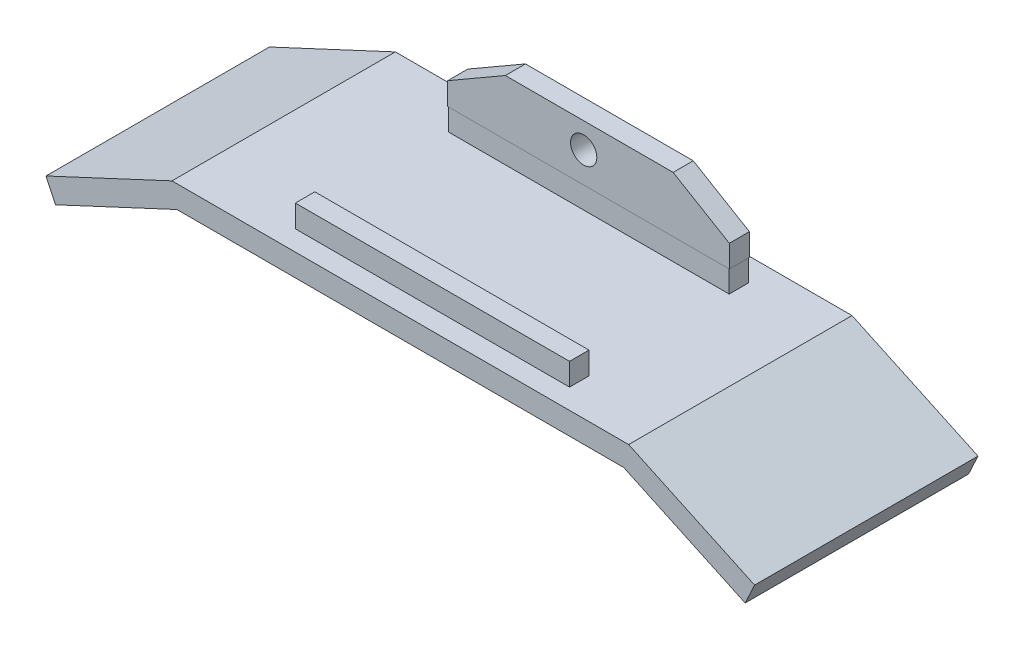
from build123d import *

# Parameters (mm, degrees)
EXTRUDE_THIN1_DEPTH = 25.4
SKETCH3_W           = 31.939411296
SKETCH3_H           = 2.21446585
BOSS_EXTRUDE1_DEPTH = 2.54
SKETCH4_W           = 31.172865425
SKETCH4_H           = 2.21446585
BOSS_EXTRUDE2_DEPTH = 2.54
BOSS_EXTRUDE3_DEPTH = 2.286
SKETCH10_R          = 1.491946279
CUT_EXTRUDE1_DEPTH  = 70.737718879


with BuildPart() as part:
    # Sketch2 → Extrude-Thin1 (new body)
    with BuildSketch(Plane.XY):
        Polygon((-13.812130674, -6.440702309), (0, 0), (50.8, 0), (64.612130674, -6.440702309), (65.685581059, -4.13868053), (51.363104443, 2.54), (-0.563104443, 2.54), (-14.885581059, -4.13868053), align=None)
    extrude(amount=EXTRUDE_THIN1_DEPTH)

    # Sketch3 → Boss-Extrude1 (add)
    with BuildSketch(Plane(origin=(0, 2.54, 0), x_dir=(1, 0, 0), z_dir=(0, 1, 0))):
        with Locations((26.294303516, -3.760480959)):
            Rectangle(SKETCH3_W, SKETCH3_H)
    extrude(amount=BOSS_EXTRUDE1_DEPTH)

    # Sketch4 → Boss-Extrude2 (add)
    with BuildSketch(Plane(origin=(0, 2.54, 0), x_dir=(1, 0, 0), z_dir=(0, 1, 0))):
        with Locations((26.762748216, -22.000859373)):
            Rectangle(SKETCH4_W, SKETCH4_H)
    extrude(amount=BOSS_EXTRUDE2_DEPTH)

    # Sketch6 → Boss-Extrude3 (add)
    with BuildSketch(Plane(origin=(0, 0, 2.653248034), x_dir=(-1, 0, 0), z_dir=(0, 0, -1))):
        Polygon((-42.349180928, 5.08), (-42.349180928, 7.62), (-35.961730939, 11.406642995), (-16.883255925, 11.406642995), (-10.324597868, 7.62), (-10.324597868, 5.08), align=None)
    extrude(amount=-BOSS_EXTRUDE3_DEPTH)

    # Sketch10 → Cut-Extrude1 (cut, through all)
    with BuildSketch(Plane.XY.offset(4.939248034)):
        with Locations((25.789671125, 8.535532201)):
            Circle(SKETCH10_R)
    extrude(amount=-CUT_EXTRUDE1_DEPTH, mode=Mode.SUBTRACT)


solid = part.part
